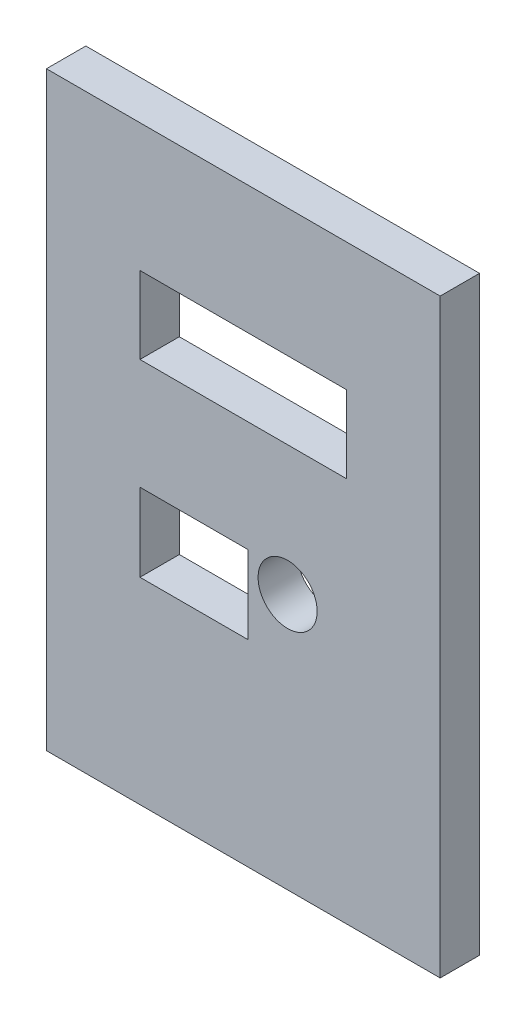
from build123d import *

# Parameters (mm, degrees)
SKETCH1_W           = 20
SKETCH1_H           = 30
BOSS_EXTRUDE1_DEPTH = 2
SKETCH2_W           = 10.5
SKETCH2_H           = 3.915369074
SKETCH2_W_2         = 5.5
SKETCH2_H_2         = 3.961570411
SKETCH2_R           = 1.5
CUT_EXTRUDE1_DEPTH  = 10


with BuildPart() as part:
    # Sketch1 → Boss-Extrude1 (new body)
    with BuildSketch(Plane.XY):
        Rectangle(SKETCH1_W, SKETCH1_H)
    extrude(amount=BOSS_EXTRUDE1_DEPTH)

    # Sketch2 → Cut-Extrude1 (cut)
    with BuildSketch(Plane.XY.offset(2)):
        with Locations((0, 6.542315463)):
            Rectangle(SKETCH2_W, SKETCH2_H)
        with Locations((-2.5, -3.015195258)):
            Rectangle(SKETCH2_W_2, SKETCH2_H_2)
        with Locations((2.25, -2)):
            Circle(SKETCH2_R)
    extrude(amount=-CUT_EXTRUDE1_DEPTH, mode=Mode.SUBTRACT)


solid = part.part
